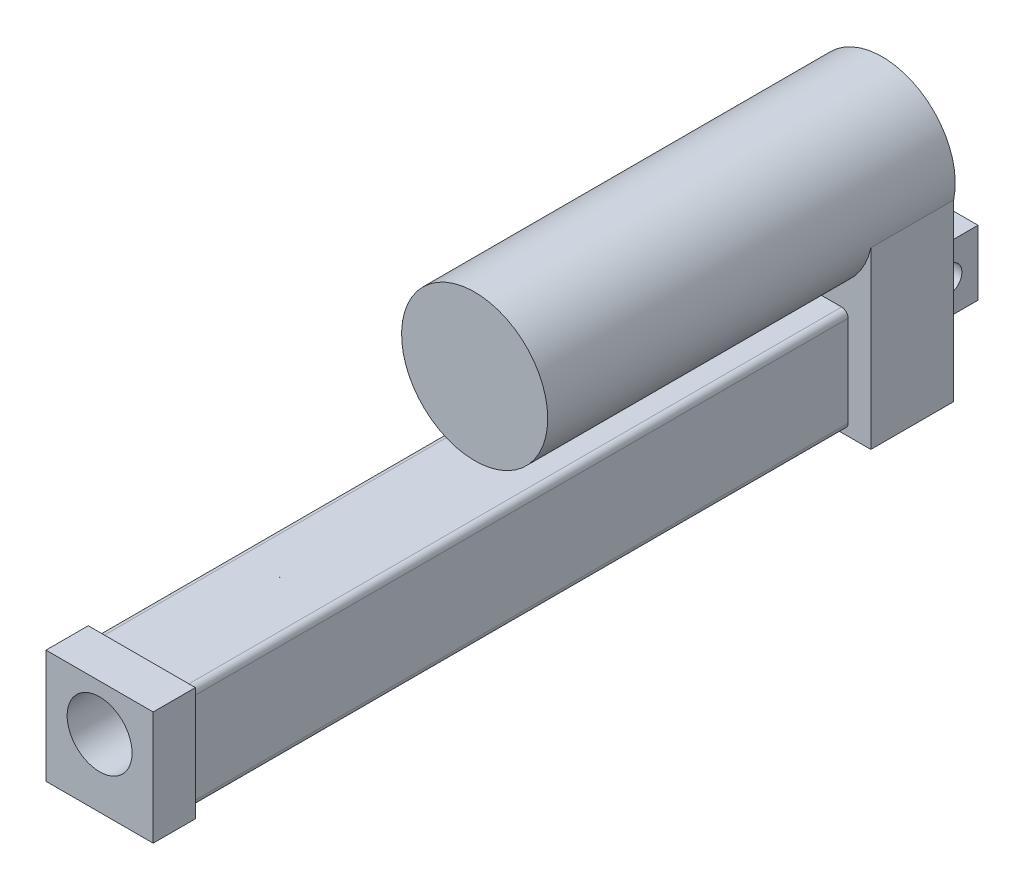
from build123d import *

# Parameters (mm, degrees)
BOSS_EXTRUDE1_DEPTH     = 25.5
SKETCH2_R               = 22.5
BOSS_EXTRUDE2_DEPTH     = 100
SKETCH3_W               = 30
SKETCH3_H               = 32
BOSS_EXTRUDE3_DEPTH     = 215.5
SKETCH4_W               = 19
SKETCH4_H               = 20
BOSS_EXTRUDE4_DEPTH     = 20
SKETCH5_R               = 4.05
CUT_EXTRUDE1_DEPTH      = 251.054494061
SKETCH6_R               = 10
BOSS_EXTRUDE5_DEPTH     = 25
SKETCH7_W               = 33
SKETCH7_H               = 35
BOSS_EXTRUDE6_DEPTH     = 13
CUT_EXTRUDE2_DEPTH      = 274.284650136
CUT_EXTRUDE2_DEPTH_BACK = 274.284650136
SKETCH8_R               = 4.05
FILLET1_R               = 2
CUT_EXTRUDE3_START      = -100
SKETCH9_R               = 10
CUT_EXTRUDE3_DEPTH      = 100


with BuildPart() as part:
    # Sketch1 → Boss-Extrude1 (new body)
    with BuildSketch(Plane.XY):
        with BuildLine():
            Line((-22, -4.716990566), (-22, -58.5))
            Line((-22, -58.5), (22, -58.5))
            Line((22, -58.5), (22, -4.716990566))
            ThreePointArc((22, -4.716990566), (0, 22.5), (-22, -4.716990566))
        make_face()
    extrude(amount=BOSS_EXTRUDE1_DEPTH)

    # Sketch2 → Boss-Extrude2 (add)
    with BuildSketch(Plane.XY.offset(25.5)):
        with Locations(Location((0, 0, 0), (0, 0, 192.101492032))):
            Circle(SKETCH2_R)
    extrude(amount=BOSS_EXTRUDE2_DEPTH)

    # Sketch3 → Boss-Extrude3 (add)
    with BuildSketch(Plane.XY.offset(25.5)):
        with Locations((0, -41)):
            Rectangle(SKETCH3_W, SKETCH3_H)
    extrude(amount=BOSS_EXTRUDE3_DEPTH)

    # Sketch4 → Boss-Extrude4 (add)
    with BuildSketch(Plane(origin=(0, 0, 0), x_dir=(-1, 0, 0), z_dir=(0, 0, -1))):
        with Locations((0, -37.7)):
            Rectangle(SKETCH4_W, SKETCH4_H)
    extrude(amount=BOSS_EXTRUDE4_DEPTH)

    # Sketch5 → Cut-Extrude1 (cut, through all)
    with BuildSketch(Plane(origin=(9.5, 0, 0), x_dir=(0, 0, -1), z_dir=(1, 0, 0))):
        with Locations((11, -37.7)):
            Circle(SKETCH5_R)
    extrude(amount=-CUT_EXTRUDE1_DEPTH, mode=Mode.SUBTRACT)

    # Sketch6 → Boss-Extrude5 (add)
    with BuildSketch(Plane.XY.offset(241)):
        with Locations((0, -37.7)):
            Circle(SKETCH6_R)
    extrude(amount=BOSS_EXTRUDE5_DEPTH)

    # Sketch7 → Boss-Extrude6 (add)
    with BuildSketch(Plane.XY.offset(241)):
        with Locations((0, -41)):
            Rectangle(SKETCH7_W, SKETCH7_H)
    extrude(amount=-BOSS_EXTRUDE6_DEPTH)

    # Sketch8 → Cut-Extrude2 (cut, two sides: drawn at the far end of the back side and taken through both)
    with BuildSketch(Plane(origin=(0, 0, 0), x_dir=(0, 0, -1), z_dir=(1, 0, 0)).offset(-CUT_EXTRUDE2_DEPTH_BACK)):
        with Locations(Location((-256, -37.7, 0), (0, 0, 179.999999993))):
            Circle(SKETCH8_R)
    extrude(amount=CUT_EXTRUDE2_DEPTH + CUT_EXTRUDE2_DEPTH_BACK, mode=Mode.SUBTRACT)

    # Fillet1
    fillet1_edges = [part.edges().sort_by_distance(p)[0] for p in [
        (15, -57, 126.75),
        (-15, -57, 126.75),
        (-15, -25, 126.75),
        (15, -25, 126.75),
    ]]
    fillet(fillet1_edges, radius=FILLET1_R)

    # Sketch9 → Cut-Extrude3 (cut)
    with BuildSketch(Plane.XY.offset(266).offset(CUT_EXTRUDE3_START)):
        with Locations((0, -37.7)):
            Circle(SKETCH9_R)
    extrude(amount=CUT_EXTRUDE3_DEPTH, mode=Mode.SUBTRACT)


solid = part.part
